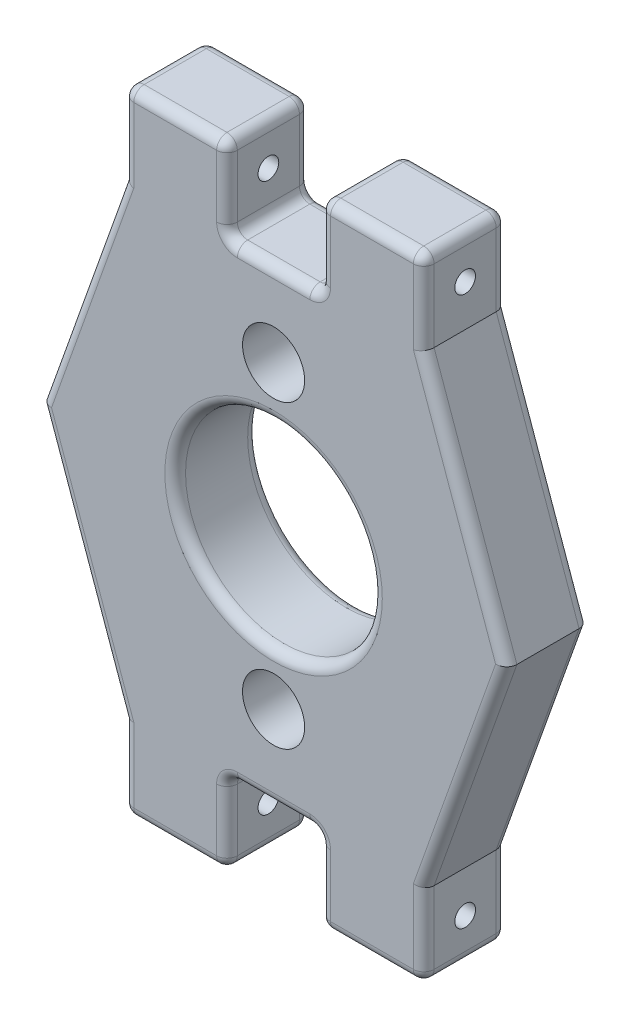
from build123d import *

# Parameters (mm, degrees)
SKETCH2_R               = 9.5
SKETCH2_W               = 10
SKETCH2_H               = 8
BOSS_EXTRUDE1_DEPTH     = 8
FILLET1_R               = 1
SKETCH3_R               = 1
CUT_EXTRUDE1_DEPTH      = 42.512046444
CUT_EXTRUDE2_DEPTH      = 39.736287896
CUT_EXTRUDE2_DEPTH_BACK = 39.736287896
SKETCH4_R               = 3


with BuildPart() as part:
    # Sketch2 → Boss-Extrude1 (new body)
    # profile 1 of 5: a face of its own
    with BuildSketch(Plane.XY):
        Polygon((22.5, 0), (14.5, -22.5), (-14.5, -22.5), (-22.5, 0), (-14.5, 22.5), (14.5, 22.5), align=None)
        Circle(SKETCH2_R, mode=Mode.SUBTRACT)
    # profile 2 of 5: a face of its own
    with BuildSketch(Plane.XY):
        with Locations((-9.5, 26.5)):
            Rectangle(SKETCH2_W, SKETCH2_H)
    # profile 3 of 5: a face of its own
    with BuildSketch(Plane.XY):
        with Locations((9.5, 26.5)):
            Rectangle(SKETCH2_W, SKETCH2_H)
    # profile 4 of 5: a face of its own
    with BuildSketch(Plane.XY):
        with Locations((9.5, -26.5)):
            Rectangle(SKETCH2_W, SKETCH2_H)
    # profile 5 of 5: a face of its own
    with BuildSketch(Plane.XY):
        with Locations((-9.5, -26.5)):
            Rectangle(SKETCH2_W, SKETCH2_H)
    extrude(amount=BOSS_EXTRUDE1_DEPTH)

    # Fillet1
    fillet1_edges = [part.edges().sort_by_distance(p)[0] for p in [
        (18.5, -11.25, 8),
        (18.5, 11.25, 8),
        (14.5, -26.5, 0),
        (14.5, 26.5, 8),
        (9.5, -30.5, 0),
        (4.5, -26.5, 0),
        (0, -22.5, 0),
        (-4.5, -26.5, 0),
        (-9.5, -30.5, 0),
        (-14.5, -26.5, 0),
        (-18.5, -11.25, 0),
        (-18.5, 11.25, 0),
        (-14.5, 26.5, 0),
        (-9.5, 30.5, 0),
        (9.5, 30.5, 8),
        (-4.5, 26.5, 0),
        (0, 22.5, 0),
        (4.5, 26.5, 0),
        (9.5, 30.5, 0),
        (14.5, 26.5, 0),
        (18.5, 11.25, 0),
        (18.5, -11.25, 0),
        (-9.5, 0, 0),
        (4.5, 26.5, 8),
        (0, 22.5, 8),
        (14.5, -30.5, 4),
        (4.5, -30.5, 4),
        (4.5, -22.5, 4),
        (-4.5, -22.5, 4),
        (-4.5, -30.5, 4),
        (-14.5, -30.5, 4),
        (-14.5, 30.5, 4),
        (-4.5, 30.5, 4),
        (-4.5, 22.5, 4),
        (4.5, 22.5, 4),
        (4.5, 30.5, 4),
        (14.5, 30.5, 4),
        (-4.5, 26.5, 8),
        (-9.5, 30.5, 8),
        (-14.5, 26.5, 8),
        (-18.5, 11.25, 8),
        (-9.5, 0, 8),
        (-18.5, -11.25, 8),
        (-14.5, -26.5, 8),
        (-9.5, -30.5, 8),
        (-4.5, -26.5, 8),
        (0, -22.5, 8),
        (4.5, -26.5, 8),
        (9.5, -30.5, 8),
        (14.5, -26.5, 8),
    ]]
    fillet(fillet1_edges, radius=FILLET1_R)

    # Sketch3 → Cut-Extrude1 (cut, symmetric)
    with BuildSketch(Plane.ZY.offset(-4.5)):
        with Locations((4, 26.5)):
            Circle(SKETCH3_R)
    cut_extrude1 = extrude(amount=CUT_EXTRUDE1_DEPTH, both=True, mode=Mode.SUBTRACT)

    # Mirror1: Cut-Extrude1 across plane
    add(cut_extrude1.mirror(Plane.ZX), mode=Mode.SUBTRACT)

    # Sketch4 → Cut-Extrude2 (cut, two sides: drawn at the far end of the back side and taken through both)
    with BuildSketch(Plane.XY.offset(8).offset(-CUT_EXTRUDE2_DEPTH_BACK)):
        with Locations((0, 14.5)):
            Circle(SKETCH4_R)
        with Locations((0, -14.5)):
            Circle(SKETCH4_R)
    extrude(amount=CUT_EXTRUDE2_DEPTH + CUT_EXTRUDE2_DEPTH_BACK, mode=Mode.SUBTRACT)


solid = part.part
